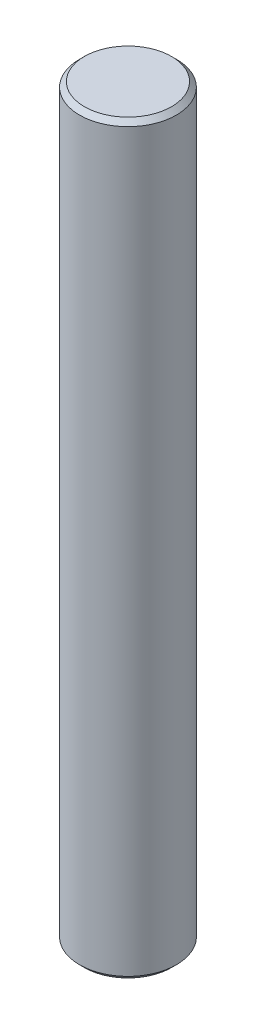
from build123d import *

# Parameters (mm, degrees)
SKETCH1_R           = 12.7
BOSS_EXTRUDE1_DEPTH = 195.58
CHAMFER1_SIZE       = 1.27


with BuildPart() as part:
    # Sketch1 → Boss-Extrude1 (new body)
    with BuildSketch(Plane(origin=(0, 0, 0), x_dir=(1, 0, 0), z_dir=(0, 1, 0))):
        with Locations(Location((0, 0, 0), (0, 0, 270))):
            Circle(SKETCH1_R)
    extrude(amount=BOSS_EXTRUDE1_DEPTH)

    # Chamfer1
    chamfer1_edges = [part.edges().sort_by_distance(p)[0] for p in [
        (0, 0, -12.7),
        (0, 195.58, -12.7),
    ]]
    chamfer(chamfer1_edges, length=CHAMFER1_SIZE)


solid = part.part
